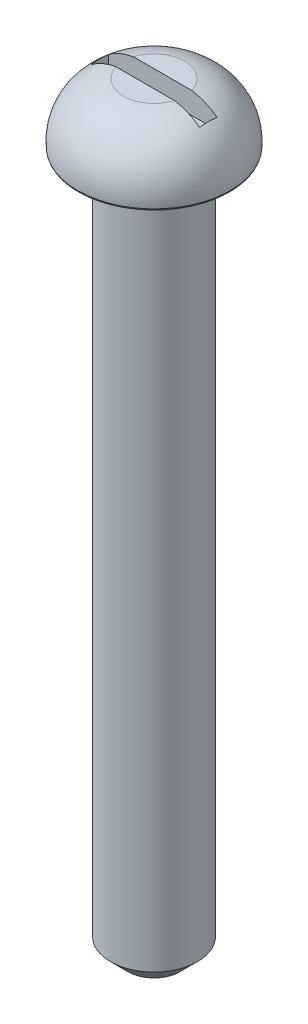
from build123d import *

# Parameters (mm, degrees)
FILLET_1_R          = 0.1
SKETCH_3_W          = 5
SKETCH_3_H          = 0.8
CUT_EXTRUDE_2_DEPTH = 1


with BuildPart() as part:
    # Эскиз1 → Повернуть1 (revolve)
    with BuildSketch(Plane.XY):
        with BuildLine():
            Line((3.5, 32.2), (2, 32.2))
            Line((2, 32.2), (2, 0.8))
            Line((2, 0.8), (1.2, 0))
            Line((1.2, 0), (0, 0))
            Line((0, 0), (0, 35))
            Line((0, 35), (1.4, 35))
            ThreePointArc((1.4, 35), (3.015564437, 34.024173328), (3.5, 32.2))
        make_face()
    revolve(axis=Axis((0, 0, 0), (0, 1, 0)))

    # Скругление1
    fillet_1_edges = [part.edges().sort_by_distance(p)[0] for p in [
        (-3.5, 32.2, 0),
    ]]
    fillet(fillet_1_edges, radius=FILLET_1_R)

    # Эскиз3 → Вырез-Вытянуть2 (cut)
    with BuildSketch(Plane(origin=(0, 35, 0), x_dir=(-1, 0, 0), z_dir=(0, 1, 0))):
        Rectangle(SKETCH_3_W, SKETCH_3_H)
    extrude(amount=-CUT_EXTRUDE_2_DEPTH, mode=Mode.SUBTRACT)


solid = part.part
